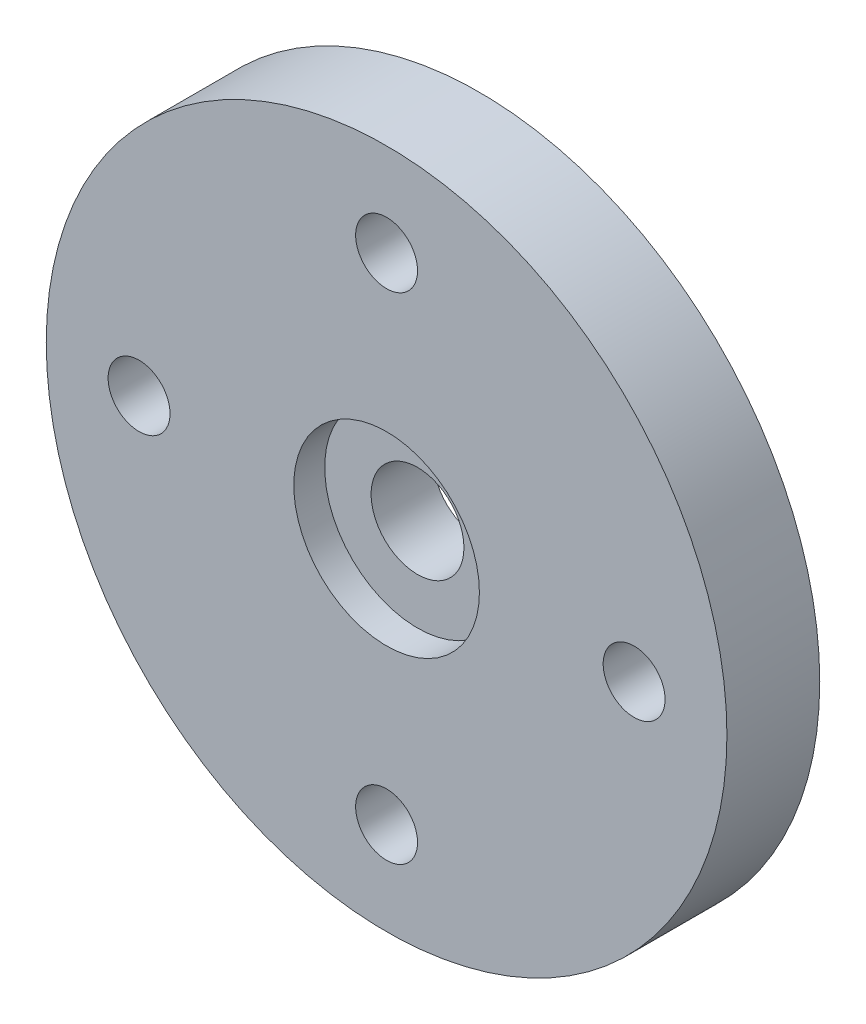
from build123d import *

# Parameters (mm, degrees)
SZKIC1_R                    = 11
SZKIC1_R_2                  = 1
SZKIC1_R_3                  = 1.5
DODANIE_WYCI_GNI_CIE1_DEPTH = 3
SZKIC2_R                    = 3
WYTNIJ_WYCI_GNI_CIE1_DEPTH  = 1


with BuildPart() as part:
    # Szkic1 → Dodanie-wyciągnięcie1 (new body)
    with BuildSketch(Plane.XY):
        Circle(SZKIC1_R)
        with Locations((0, 8)):
            Circle(SZKIC1_R_2, mode=Mode.SUBTRACT)
        with Locations((8, 0)):
            Circle(SZKIC1_R_2, mode=Mode.SUBTRACT)
        with Locations((0, -8)):
            Circle(SZKIC1_R_2, mode=Mode.SUBTRACT)
        with Locations((-8, 0)):
            Circle(SZKIC1_R_2, mode=Mode.SUBTRACT)
        Circle(SZKIC1_R_3, mode=Mode.SUBTRACT)
    extrude(amount=DODANIE_WYCI_GNI_CIE1_DEPTH)

    # Szkic2 → Wytnij-wyciągnięcie1 (cut)
    with BuildSketch(Plane.XY.offset(3)):
        Circle(SZKIC2_R)
    extrude(amount=-WYTNIJ_WYCI_GNI_CIE1_DEPTH, mode=Mode.SUBTRACT)


solid = part.part
